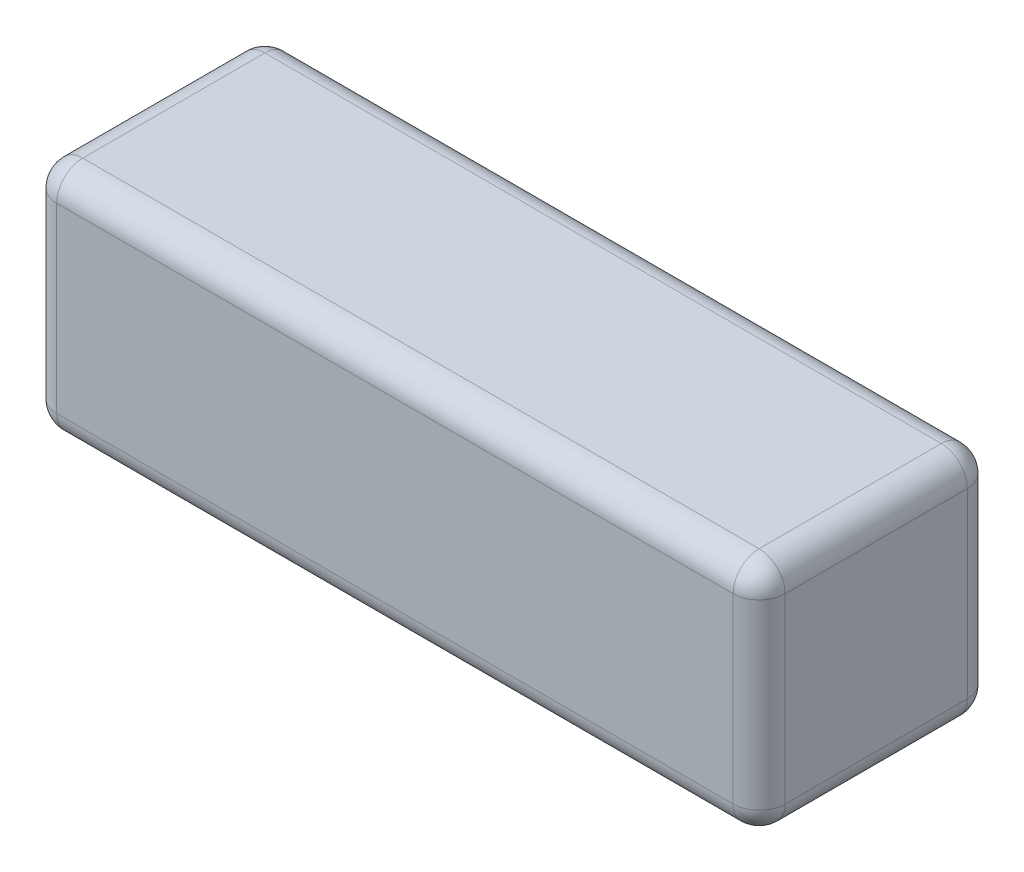
from build123d import *

# Parameters (mm, degrees)
SKETCH2_W           = 140
SKETCH2_H           = 45
BOSS_EXTRUDE1_DEPTH = 45
FILLET1_R           = 5


with BuildPart() as part:
    # Sketch2 → Boss-Extrude1 (new body)
    with BuildSketch(Plane.XY):
        Rectangle(SKETCH2_W, SKETCH2_H)
    extrude(amount=BOSS_EXTRUDE1_DEPTH)

    # Fillet1
    fillet1_edges = [part.edges().sort_by_distance(p)[0] for p in [
        (-70, 0, 45),
        (0, -22.5, 45),
        (70, 0, 45),
        (0, -22.5, 0),
        (-70, 0, 0),
        (0, 22.5, 0),
        (70, 0, 0),
        (70, -22.5, 22.5),
        (-70, -22.5, 22.5),
        (-70, 22.5, 22.5),
        (70, 22.5, 22.5),
        (0, 22.5, 45),
    ]]
    fillet(fillet1_edges, radius=FILLET1_R)


solid = part.part
